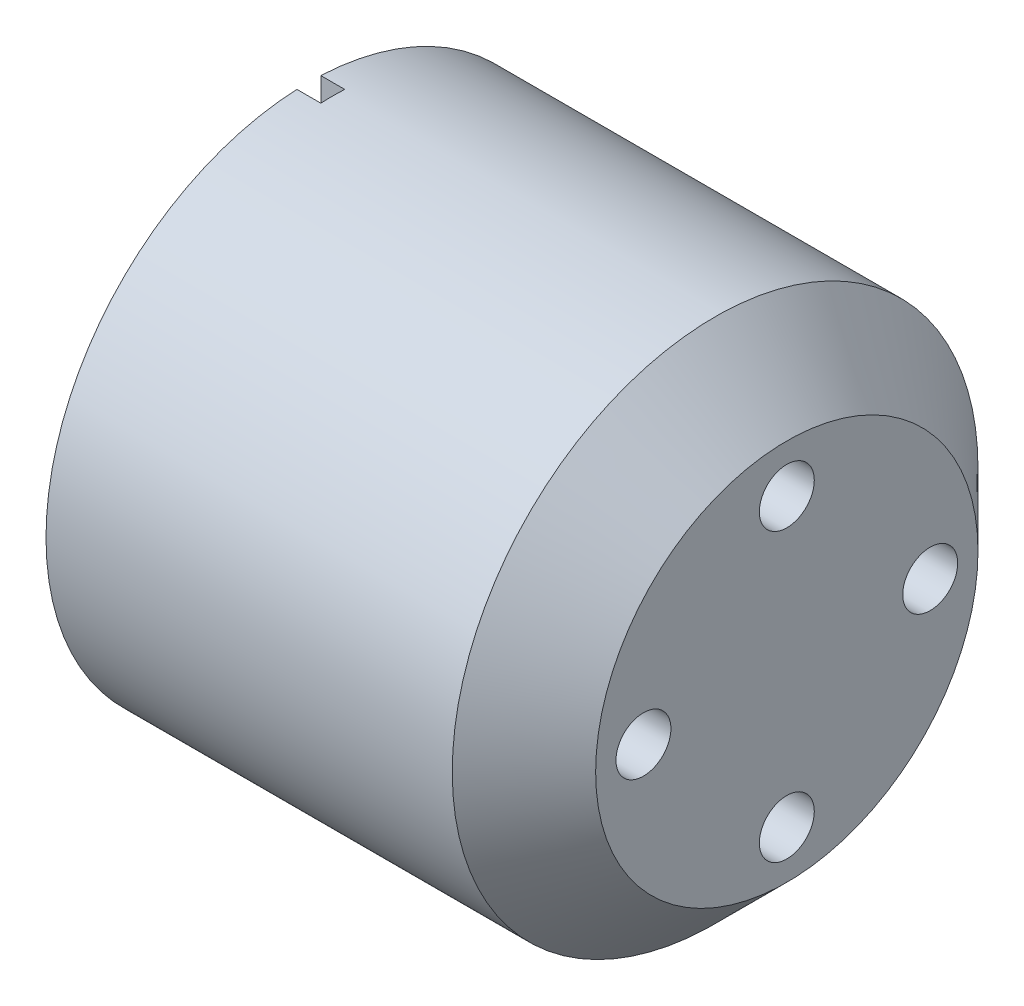
from build123d import *

# Parameters (mm, degrees)
SKETCH2_R           = 11
SKETCH2_R_2         = 1.15
BOSS_EXTRUDE1_DEPTH = 20
CHAMFER1_SIZE       = 3
SKETCH5_R           = 2
CUT_EXTRUDE2_DEPTH  = 14.5
SKETCH6_R           = 2
CUT_EXTRUDE3_DEPTH  = 8
CHAMFER2_SIZE       = 0.3
CHAMFER2_SIZE2      = 1.2
SKETCH7_W           = 1
SKETCH7_H           = 3
CUT_EXTRUDE4_DEPTH  = 1


with BuildPart() as part:
    # Sketch2 → Boss-Extrude1 (new body)
    with BuildSketch(Plane(origin=(0, 0, 0), x_dir=(0, 0, -1), z_dir=(1, 0, 0))):
        Circle(SKETCH2_R)
        with Locations((0, 6)):
            Circle(SKETCH2_R_2, mode=Mode.SUBTRACT)
        with Locations((-6, 0)):
            Circle(SKETCH2_R_2, mode=Mode.SUBTRACT)
        with Locations((0, -6)):
            Circle(SKETCH2_R_2, mode=Mode.SUBTRACT)
        with Locations((6, 0)):
            Circle(SKETCH2_R_2, mode=Mode.SUBTRACT)
    extrude(amount=BOSS_EXTRUDE1_DEPTH)

    # Chamfer1
    chamfer1_edges = [part.edges().sort_by_distance(p)[0] for p in [
        (20, 0, 11),
    ]]
    chamfer(chamfer1_edges, length=CHAMFER1_SIZE)

    # Sketch5 → Cut-Extrude2 (cut)
    with BuildSketch(Plane.ZY):
        with Locations((-6, 0)):
            Circle(SKETCH5_R)
        with Locations((0, 6)):
            Circle(SKETCH5_R)
        with Locations((0, -6)):
            Circle(SKETCH5_R)
        with Locations((6, 0)):
            Circle(SKETCH5_R)
    extrude(amount=-CUT_EXTRUDE2_DEPTH, mode=Mode.SUBTRACT)

    # Sketch6 → Cut-Extrude3 (cut)
    with BuildSketch(Plane.ZY):
        with Locations((5.303300859, 5.303300859)):
            Circle(SKETCH6_R)
        with Locations((-5.303300859, 5.303300859)):
            Circle(SKETCH6_R)
        with Locations((-5.303300859, -5.303300859)):
            Circle(SKETCH6_R)
        with Locations((5.303300859, -5.303300859)):
            Circle(SKETCH6_R)
    extrude(amount=-CUT_EXTRUDE3_DEPTH, mode=Mode.SUBTRACT)

    # Chamfer2
    chamfer2_edges = [part.edges().sort_by_distance(p)[0] for p in [
        (0, -5.303300859, 3.303300859),
        (0, -5.303300859, -7.303300859),
        (0, 5.303300859, -7.303300859),
        (0, 5.303300859, 3.303300859),
    ]]
    chamfer2_side = [part.faces().sort_by_distance(p)[0] for p in [
        (0, 0, 0),
    ]]
    chamfer(chamfer2_edges, length=CHAMFER2_SIZE, length2=CHAMFER2_SIZE2, reference=chamfer2_side[0])

    # Sketch7 → Cut-Extrude4 (cut)
    with BuildSketch(Plane.ZY):
        with Locations((0, 11)):
            Rectangle(SKETCH7_W, SKETCH7_H)
    extrude(amount=-CUT_EXTRUDE4_DEPTH, mode=Mode.SUBTRACT)


solid = part.part
